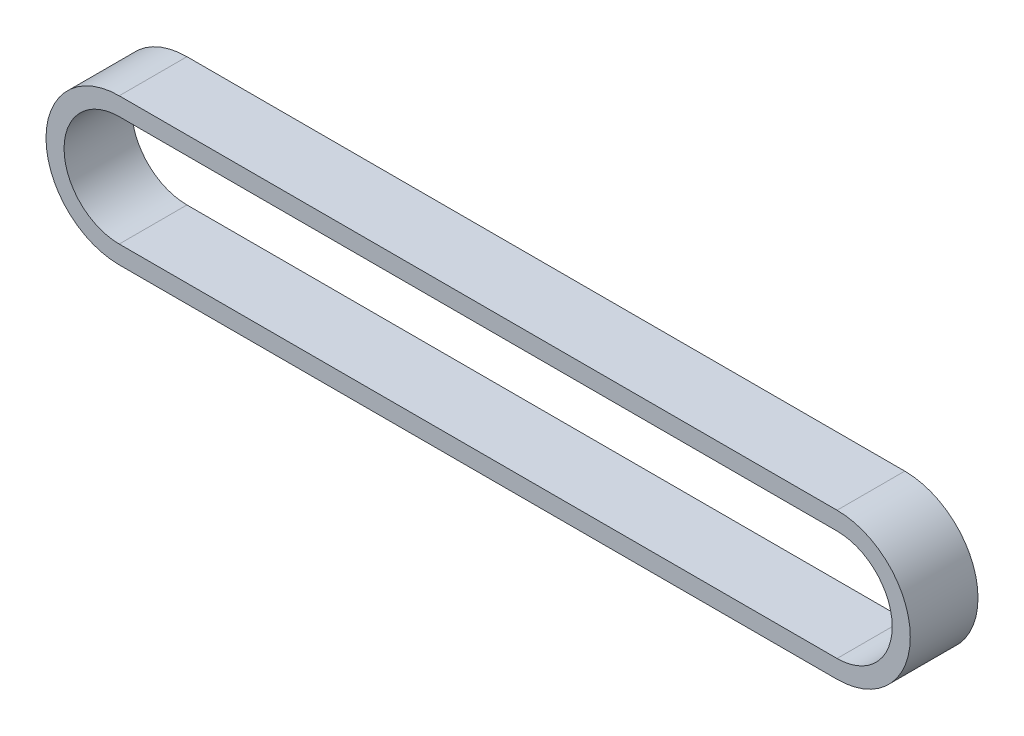
from build123d import *

# Parameters (mm, degrees)
BOSS_EXTRUDE1_DEPTH = 7.5


with BuildPart() as part:
    # Sketch1 → Boss-Extrude1 (new body)
    with BuildSketch(Plane.XY):
        with BuildLine():
            Line((-39.75, 8.11), (39.75, 8.11))
            ThreePointArc((39.75, 8.11), (47.86, 0), (39.75, -8.11))
            Line((39.75, -8.11), (-39.75, -8.11))
            ThreePointArc((-39.75, -8.11), (-47.86, 0), (-39.75, 8.11))
        make_face()
        with BuildLine():
            Line((-39.75, 6.11), (39.75, 6.11))
            ThreePointArc((39.75, 6.11), (45.86, 0), (39.75, -6.11))
            Line((39.75, -6.11), (-39.75, -6.11))
            ThreePointArc((-39.75, -6.11), (-45.86, 0), (-39.75, 6.11))
        make_face(mode=Mode.SUBTRACT)
    extrude(amount=BOSS_EXTRUDE1_DEPTH)


solid = part.part
